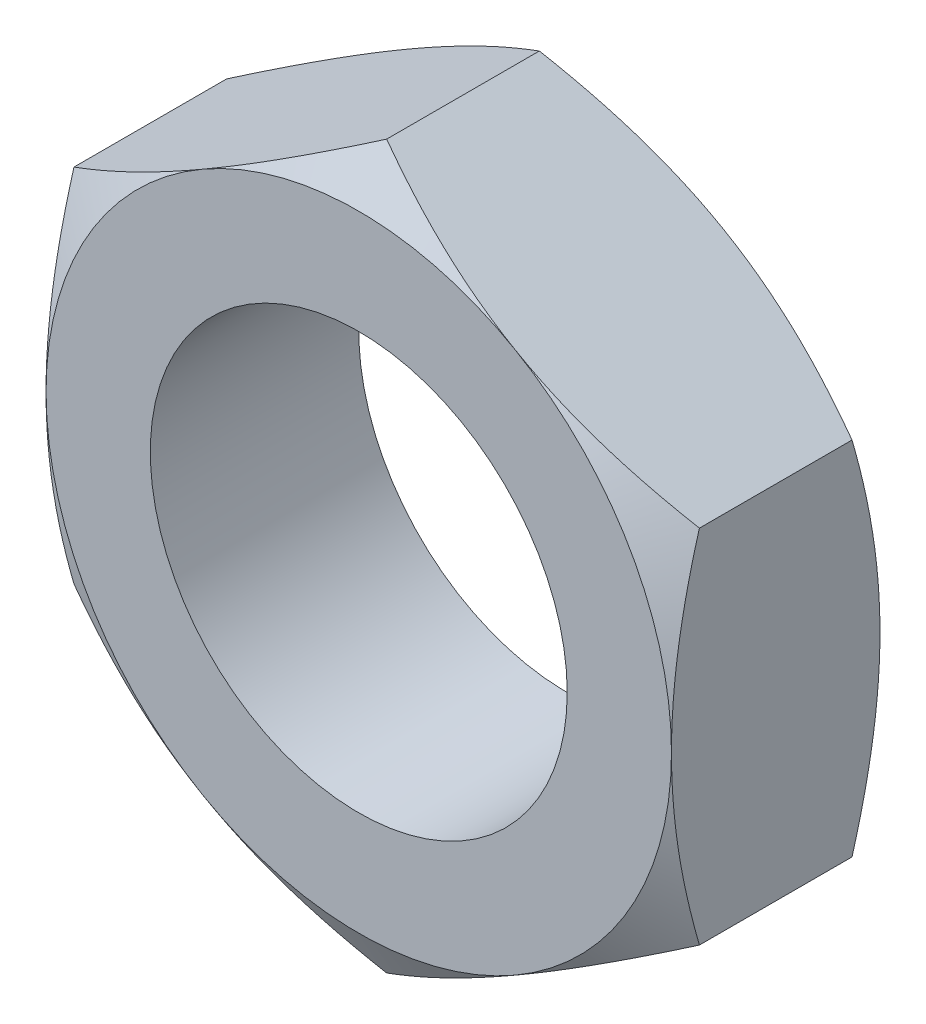
from build123d import *

# Parameters (mm, degrees)
SZKIC1_R                    = 8
DODANIE_WYCI_GNI_CIE1_DEPTH = 4
SZKIC2_OUTSIDE_W            = 61.218
SZKIC2_OUTSIDE_H            = 64.93
SZKIC2_OUTSIDE_R            = 12
WYTNIJ_WYCI_GNI_CIE2_DEPTH  = 8
WYTNIJ_WYCI_GNI_CIE2_DRAFT  = -60
LUSTRO1_COPY_1_SKETCH_W     = 61.218
LUSTRO1_COPY_1_SKETCH_H     = 64.93
LUSTRO1_COPY_1_SKETCH_R     = 12
LUSTRO1_COPY_1_DEPTH        = 8
LUSTRO1_COPY_1_DRAFT        = -60


with BuildPart() as part:
    # Szkic1 → Dodanie-wyciągnięcie1 (new, symmetric)
    with BuildSketch(Plane.XY):
        Polygon((-12, 6.92820323), (-12, -6.92820323), (0, -13.856406461), (12, -6.92820323), (12, 6.92820323), (0, 13.856406461), align=None)
        Circle(SZKIC1_R, mode=Mode.SUBTRACT)
    extrude(amount=DODANIE_WYCI_GNI_CIE1_DEPTH, both=True)


with BuildPart() as wytnij_wyci_gni_cie2_tool:
    # Szkic2 outside → Wytnij-wyciągnięcie2 (with draft: the straight prism first)
    with BuildSketch(Plane.XY.offset(4)):
        Rectangle(SZKIC2_OUTSIDE_W, SZKIC2_OUTSIDE_H)
        Circle(SZKIC2_OUTSIDE_R, mode=Mode.SUBTRACT)
    extrude(amount=-WYTNIJ_WYCI_GNI_CIE2_DEPTH)
    # Wytnij-wyciągnięcie2: the draft: its side faces are tilted about the plane it starts from
    wytnij_wyci_gni_cie2_sides = [wytnij_wyci_gni_cie2_tool.faces().sort_by_distance(p)[0] for p in [
        (0, -32.465, 0),
        (30.609, 0, 0),
        (0, 32.465, 0),
        (-30.609, 0, 0),
        (-12, 0, 0),
    ]]
    draft(wytnij_wyci_gni_cie2_sides, Plane.XY.offset(4), WYTNIJ_WYCI_GNI_CIE2_DRAFT)


with BuildPart() as part_1:
    add(part.part)

    # Wytnij-wyciągnięcie2: cut by wytnij_wyci_gni_cie2_tool
    add(wytnij_wyci_gni_cie2_tool.part, mode=Mode.SUBTRACT)


with BuildPart() as lustro1_copy_1_tool:
    # Lustro1 copy 1 sketch → Lustro1 copy 1 (with draft: the straight prism first)
    with BuildSketch(Plane(origin=(0, 0, -4), x_dir=(1, 0, 0), z_dir=(0, 0, -1))):
        Rectangle(LUSTRO1_COPY_1_SKETCH_W, LUSTRO1_COPY_1_SKETCH_H)
        Circle(LUSTRO1_COPY_1_SKETCH_R, mode=Mode.SUBTRACT)
    extrude(amount=-LUSTRO1_COPY_1_DEPTH)
    # Lustro1 copy 1: the draft: its side faces are tilted about the plane it starts from
    lustro1_copy_1_sides = [lustro1_copy_1_tool.faces().sort_by_distance(p)[0] for p in [
        (0, -32.465, 0),
        (30.609, 0, 0),
        (0, 32.465, 0),
        (-30.609, 0, 0),
        (-12, 0, 0),
    ]]
    draft(lustro1_copy_1_sides, Plane(origin=(0, 0, -4), x_dir=(1, 0, 0), z_dir=(0, 0, -1)), LUSTRO1_COPY_1_DRAFT)


with BuildPart() as part_2:
    add(part_1.part)

    # Lustro1 copy 1: cut by lustro1_copy_1_tool
    add(lustro1_copy_1_tool.part, mode=Mode.SUBTRACT)


solid = part_2.part
